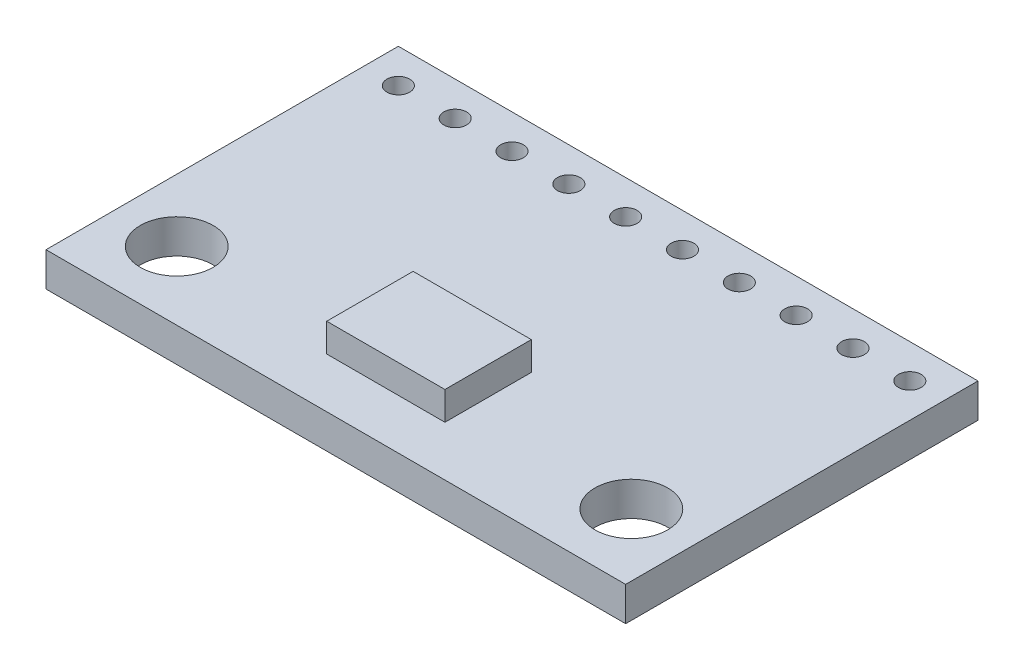
from build123d import *

# Parameters (mm, degrees)
SKETCH1_W           = 25.5
SKETCH1_H           = 15.5
SKETCH1_R           = 1.6
BOSS_EXTRUDE1_DEPTH = 1.5
SKETCH2_W           = 5.2
SKETCH2_H           = 3.8
BOSS_EXTRUDE2_DEPTH = 1.25
SKETCH3_R           = 0.5
CUT_EXTRUDE1_DEPTH  = 15.995832754
LPATTERN1_COUNT     = 10
LPATTERN1_PITCH     = 2.5


with BuildPart() as part:
    # Sketch1 → Boss-Extrude1 (new body)
    with BuildSketch(Plane(origin=(0, 0, 0), x_dir=(1, 0, 0), z_dir=(0, 1, 0))):
        Rectangle(SKETCH1_W, SKETCH1_H)
        with Locations(Location((-10, -4.75, 0), (0, 0, 270))):
            Circle(SKETCH1_R, mode=Mode.SUBTRACT)
        with Locations(Location((10, -4.75, 0), (0, 0, 270))):
            Circle(SKETCH1_R, mode=Mode.SUBTRACT)
    extrude(amount=BOSS_EXTRUDE1_DEPTH)

    # Sketch2 → Boss-Extrude2 (add)
    with BuildSketch(Plane(origin=(0, 1.5, 0), x_dir=(1, 0, 0), z_dir=(0, 1, 0))):
        with Locations((0, -3.65)):
            Rectangle(SKETCH2_W, SKETCH2_H)
    extrude(amount=BOSS_EXTRUDE2_DEPTH)

    # Sketch3 → Cut-Extrude1 (cut, through all)
    with BuildSketch(Plane(origin=(0, 1.5, 0), x_dir=(1, 0, 0), z_dir=(0, 1, 0))):
        with Locations(Location((-11.25, 6.25, 0), (0, 0, 270))):
            Circle(SKETCH3_R)
    cut_extrude1 = extrude(amount=-CUT_EXTRUDE1_DEPTH, mode=Mode.SUBTRACT)

    # LPattern1: Cut-Extrude1 ×10
    with Locations(*[(i * LPATTERN1_PITCH, 0, 0) for i in range(1, LPATTERN1_COUNT)]):
        add(cut_extrude1, mode=Mode.SUBTRACT)


solid = part.part
